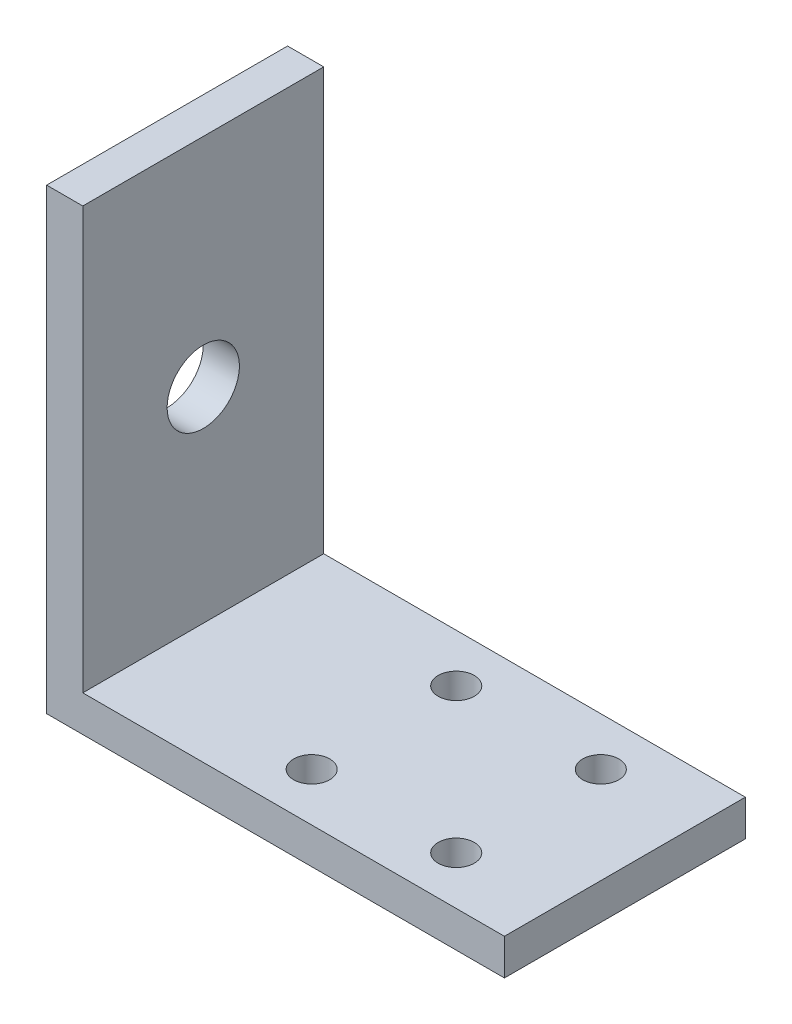
from build123d import *

# Parameters (mm, degrees)
EXTRUDE_1_DEPTH     = 20
SKETCH_2_R          = 3
CUT_EXTRUDE_1_DEPTH = 58.341084747
SKETCH_3_R          = 1.5
CUT_EXTRUDE_2_DEPTH = 56.398555938


with BuildPart() as part:
    # 草图1 → 凸台-拉伸1 (new body)
    with BuildSketch(Plane.XY):
        Polygon((0, 0), (0, 38), (3, 38), (3, 3), (38, 3), (38, 0), align=None)
    extrude(amount=EXTRUDE_1_DEPTH)

    # 草图2 → 切除-拉伸1 (cut, through all)
    with BuildSketch(Plane.ZY):
        with Locations((10, 20)):
            Circle(SKETCH_2_R)
    extrude(amount=-CUT_EXTRUDE_1_DEPTH, mode=Mode.SUBTRACT)

    # 草图3 → 切除-拉伸2 (cut, through all)
    with BuildSketch(Plane(origin=(0, 3, 0), x_dir=(1, 0, 0), z_dir=(0, 1, 0))):
        with Locations(Location((18, -4, 0), (0, 0, 270))):
            Circle(SKETCH_3_R)
        with Locations(Location((18, -16, 0), (0, 0, 270))):
            Circle(SKETCH_3_R)
        with Locations(Location((30, -4, 0), (0, 0, 270))):
            Circle(SKETCH_3_R)
        with Locations(Location((30, -16, 0), (0, 0, 270))):
            Circle(SKETCH_3_R)
    extrude(amount=-CUT_EXTRUDE_2_DEPTH, mode=Mode.SUBTRACT)


solid = part.part
